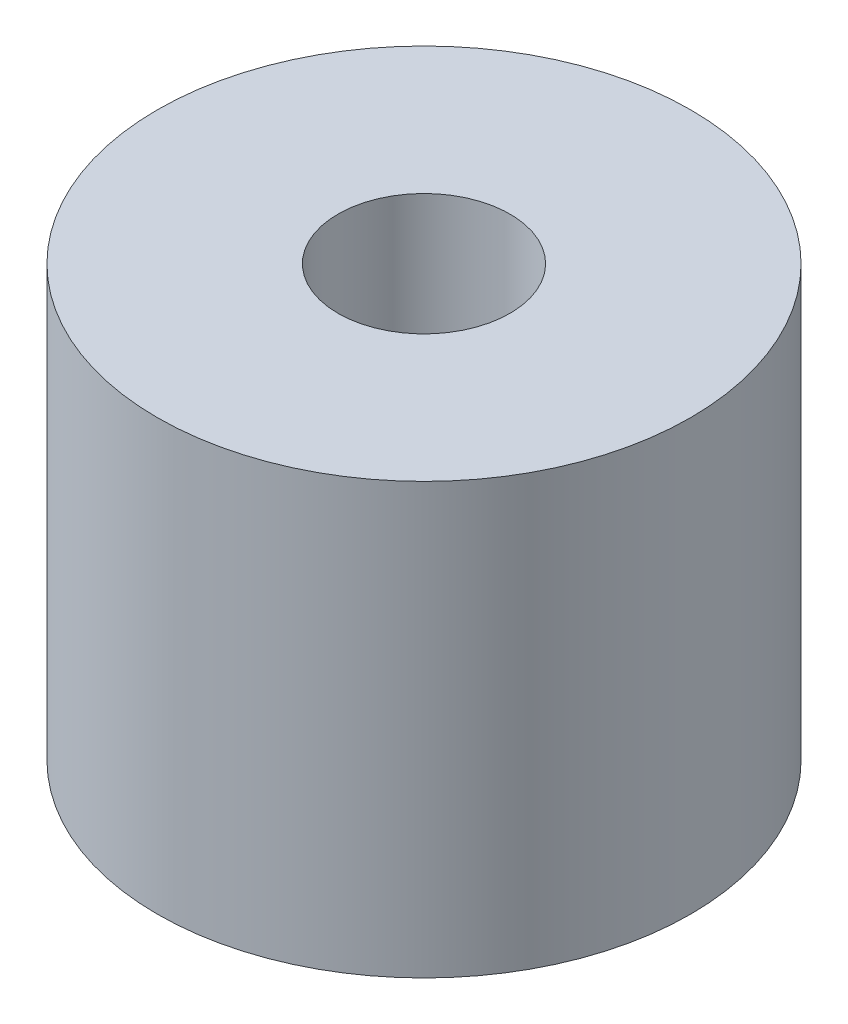
from build123d import *

# Parameters (mm, degrees)
SKETCH1_R              = 15.5
BOSS_EXTRUDE1_DEPTH    = 12.5
F_10_0MM_DOWEL_HOLE2_D = 10


with BuildPart() as part:
    # Sketch1 → Boss-Extrude1 (new, symmetric)
    with BuildSketch(Plane(origin=(0, 0, 0), x_dir=(1, 0, 0), z_dir=(0, 1, 0))):
        with Locations(Location((0, 0, 0), (0, 0, 270))):
            Circle(SKETCH1_R)
    extrude(amount=BOSS_EXTRUDE1_DEPTH, both=True)

    # Ø10.0mm Dowel Hole2 (through all)
    with Locations(Plane(origin=(0, 12.5, 0), x_dir=(1, 0, 0), z_dir=(0, 1, 0))):
        with Locations((0, 0)):
            Hole(F_10_0MM_DOWEL_HOLE2_D / 2)


solid = part.part
